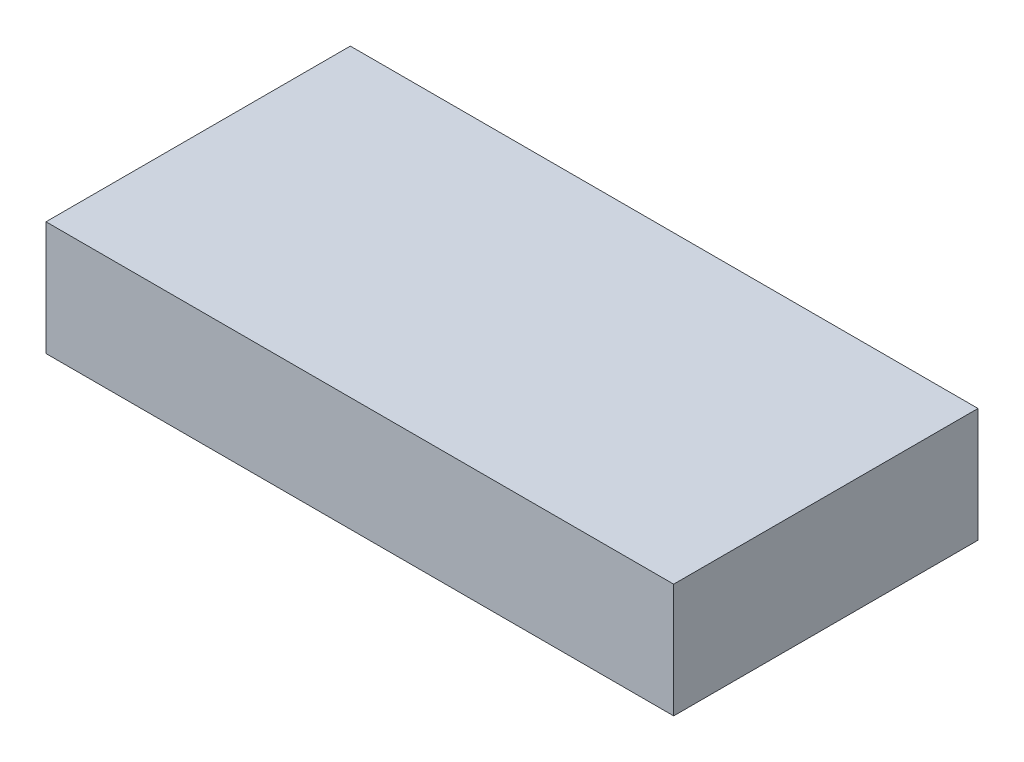
from build123d import *

# Parameters (mm, degrees)
SKETCH1_W           = 33
SKETCH1_H           = 16
BOSS_EXTRUDE1_DEPTH = 3


with BuildPart() as part:
    # Sketch1 → Boss-Extrude1 (new, symmetric)
    with BuildSketch(Plane(origin=(0, 0, 0), x_dir=(1, 0, 0), z_dir=(0, 1, 0))):
        Rectangle(SKETCH1_W, SKETCH1_H)
    extrude(amount=BOSS_EXTRUDE1_DEPTH, both=True)


solid = part.part
